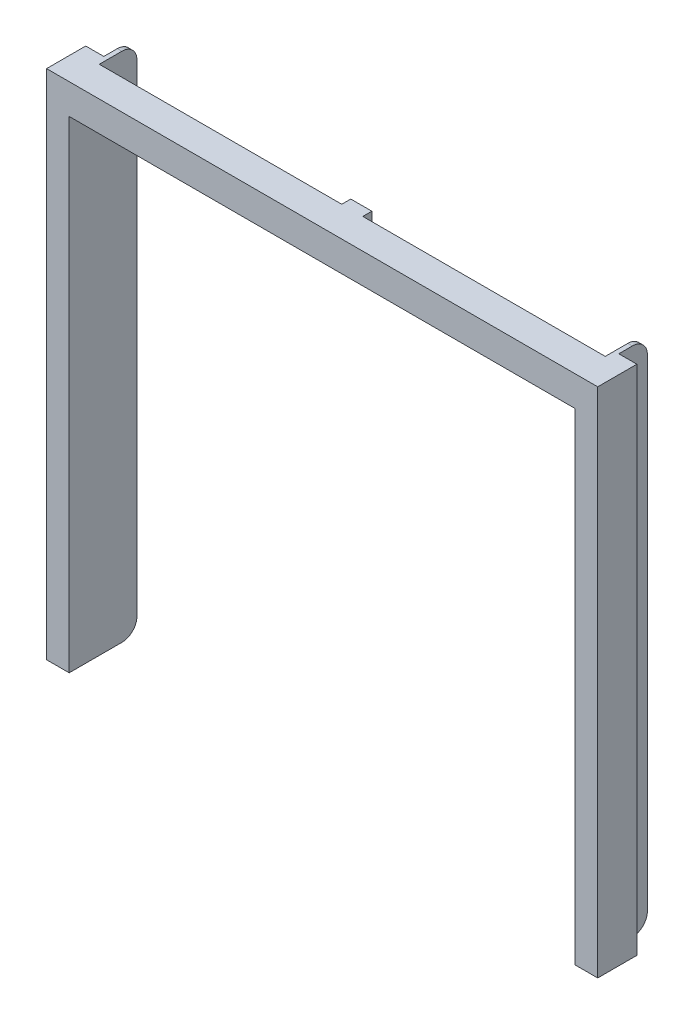
from build123d import *

# Parameters (mm, degrees)
EXTRUDE_1_DEPTH     = 26
SKETCH_1_4_W        = 3
SKETCH_1_4_H        = 340
EXTRUDE_2_DEPTH     = 19
FILLET_1_R          = 10
SKETCH_5_W          = 161
SKETCH_5_H          = 6
CUT_EXTRUDE_1_DEPTH = 52


with BuildPart() as part:
    # 스케치1 → 보스-돌출1 (new body)
    with BuildSketch(Plane.XY):
        Polygon((-168, 0), (168, 0), (183, 0), (183, -340), (168, -340), (168, -20), (-168, -20), (-168, -340), (-183, -340), (-183, 0), align=None)
    extrude(amount=EXTRUDE_1_DEPTH)

    # 스케치1<4> → 보스-돌출2 (add)
    with BuildSketch(Plane.XY):
        with Locations((-169.5, -170)):
            Rectangle(SKETCH_1_4_W, SKETCH_1_4_H)
        with Locations((169.5, -170)):
            Rectangle(SKETCH_1_4_W, SKETCH_1_4_H)
    extrude(amount=-EXTRUDE_2_DEPTH)

    # 필렛1
    fillet_1_edges = [part.edges().sort_by_distance(p)[0] for p in [
        (-169.5, 0, -19),
        (169.5, 0, -19),
        (169.5, -340, -19),
        (-169.5, -340, -19),
    ]]
    fillet(fillet_1_edges, radius=FILLET_1_R)

    # 스케치5 → 컷-돌출1 (cut)
    with BuildSketch(Plane(origin=(0, 0, 0), x_dir=(1, 0, 0), z_dir=(0, 1, 0))):
        with Locations((-87.5, -3)):
            Rectangle(SKETCH_5_W, SKETCH_5_H)
        with Locations((87.5, -3)):
            Rectangle(SKETCH_5_W, SKETCH_5_H)
    extrude(amount=-CUT_EXTRUDE_1_DEPTH, mode=Mode.SUBTRACT)


solid = part.part
